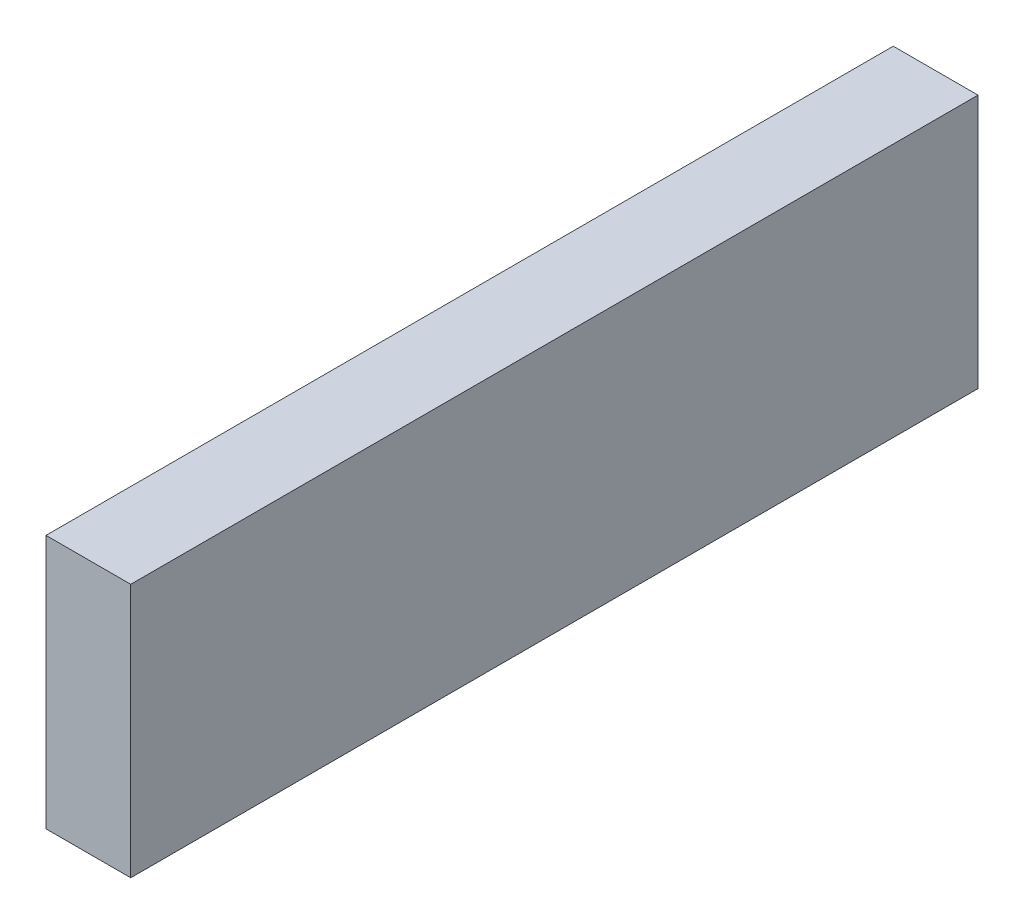
from build123d import *

# Parameters (mm, degrees)
SKETCH1_W           = 50.8
SKETCH1_H           = 152.4
BOSS_EXTRUDE1_DEPTH = 508


with BuildPart() as part:
    # Sketch1 → Boss-Extrude1 (new body)
    with BuildSketch(Plane.XY):
        with Locations((-25.4, 76.2)):
            Rectangle(SKETCH1_W, SKETCH1_H)
    extrude(amount=BOSS_EXTRUDE1_DEPTH)


solid = part.part
